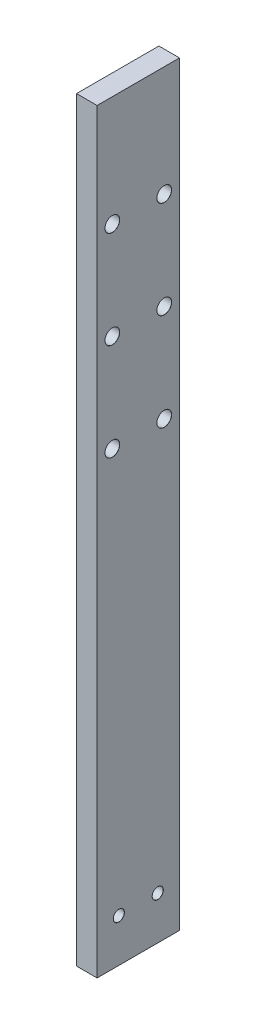
from build123d import *

# Parameters (mm, degrees)
SKETCH1_W                      = 25.4
SKETCH1_H                      = 232.968
BOSS_EXTRUDE1_DEPTH            = 6.35
M3_CLEARANCE_HOLE1_D           = 3.4
M3_CLEARANCE_HOLE1_DEPTH       = 7.493
M3_CLEARANCE_HOLE1_CSINK_D     = 3.45
M3_CLEARANCE_HOLE1_CSINK_ANGLE = 100
M3_CLEARANCE_HOLE1_TIP         = 1.021463052
M4_CLEARANCE_HOLE1_D           = 4.5
M4_CLEARANCE_HOLE1_DEPTH       = 10.1000052
M4_CLEARANCE_HOLE1_CSINK_D     = 4.55
M4_CLEARANCE_HOLE1_CSINK_ANGLE = 100
M4_CLEARANCE_HOLE1_TIP         = 1.351936393


with BuildPart() as part:
    # Sketch1 → Boss-Extrude1 (new body)
    with BuildSketch(Plane(origin=(0, 0, 0), x_dir=(0, 0, -1), z_dir=(1, 0, 0))):
        with Locations((12.7, 116.484)):
            Rectangle(SKETCH1_W, SKETCH1_H)
    extrude(amount=BOSS_EXTRUDE1_DEPTH)

    # M3 Clearance Hole1
    with Locations(Plane(origin=(6.35, 0, 0), x_dir=(0, 0, -1), z_dir=(1, 0, 0))):
        with Locations((6.7, 13.3), (18.7, 13.3)):
            CounterSinkHole(M3_CLEARANCE_HOLE1_D / 2, M3_CLEARANCE_HOLE1_CSINK_D / 2, depth=M3_CLEARANCE_HOLE1_DEPTH, counter_sink_angle=M3_CLEARANCE_HOLE1_CSINK_ANGLE)
            with Locations((0, 0, -(M3_CLEARANCE_HOLE1_DEPTH + M3_CLEARANCE_HOLE1_TIP / 2))):  # 118° drill point
                Cone(0, M3_CLEARANCE_HOLE1_D / 2, M3_CLEARANCE_HOLE1_TIP, mode=Mode.SUBTRACT)

    # M4 Clearance Hole1
    with Locations(Plane(origin=(6.35, 0, 0), x_dir=(0, 0, -1), z_dir=(1, 0, 0))):
        with Locations((4.7, 198.968), (4.7, 168.968), (4.7, 138.968), (20.7, 138.968), (20.7, 168.968), (20.7, 198.968)):
            CounterSinkHole(M4_CLEARANCE_HOLE1_D / 2, M4_CLEARANCE_HOLE1_CSINK_D / 2, depth=M4_CLEARANCE_HOLE1_DEPTH, counter_sink_angle=M4_CLEARANCE_HOLE1_CSINK_ANGLE)
            with Locations((0, 0, -(M4_CLEARANCE_HOLE1_DEPTH + M4_CLEARANCE_HOLE1_TIP / 2))):  # 118° drill point
                Cone(0, M4_CLEARANCE_HOLE1_D / 2, M4_CLEARANCE_HOLE1_TIP, mode=Mode.SUBTRACT)


solid = part.part
